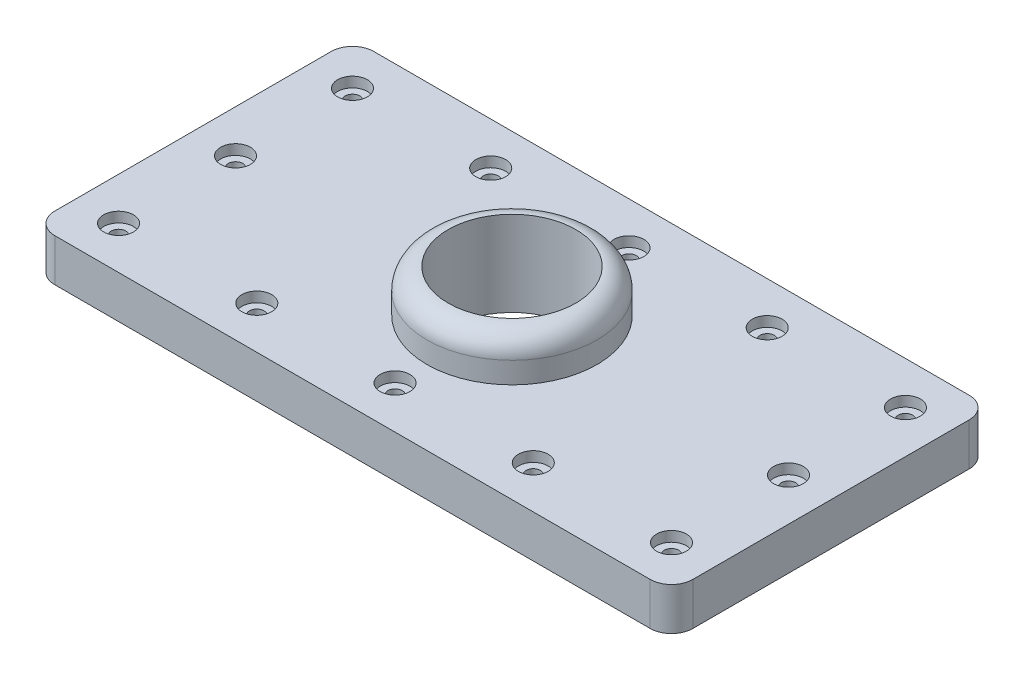
from build123d import *

# Parameters (mm, degrees)
PROFIL_BASE_W                                      = 150
PROFIL_BASE_H                                      = 75
BASE_DEPTH                                         = 10
PROFIL_CYLINDRE_R                                  = 20
CYLINDRE_DEPTH                                     = 10
CONG_1_R                                           = 5
PER_AGE_CENTRAL_D                                  = 30
CHAMBRAGE_POUR_VIS_T_TE_RONDE_BOMB_E_M_D           = 3.4
CHAMBRAGE_POUR_VIS_T_TE_RONDE_BOMB_E_M_CBORE_D     = 7
CHAMBRAGE_POUR_VIS_T_TE_RONDE_BOMB_E_M_CBORE_DEPTH = 2.4
R_P_TITION_LIN_AIRE1_COUNT                         = 5
R_P_TITION_LIN_AIRE1_PITCH                         = 32.5
R_P_TITION_LIN_AIRE1_COUNT_DIR2                    = 3
R_P_TITION_LIN_AIRE1_PITCH_DIR2                    = 27.5


with BuildPart() as part:
    # Profil Base → Base (new body)
    with BuildSketch(Plane(origin=(0, 0, 0), x_dir=(1, 0, 0), z_dir=(0, 1, 0))):
        Rectangle(PROFIL_BASE_W, PROFIL_BASE_H)
    extrude(amount=BASE_DEPTH)

    # Profil Cylindre → Cylindre (add)
    with BuildSketch(Plane(origin=(0, 10, 0), x_dir=(1, 0, 0), z_dir=(0, 1, 0))):
        with Locations(Location((0, 0, 0), (0, 0, 270))):
            Circle(PROFIL_CYLINDRE_R)
    extrude(amount=CYLINDRE_DEPTH)

    # Congé1
    cong_1_edges = [part.edges().sort_by_distance(p)[0] for p in [
        (0, 20, -20),
        (75, 5, 37.5),
        (-75, 5, 37.5),
        (-75, 5, -37.5),
        (75, 5, -37.5),
    ]]
    fillet(cong_1_edges, radius=CONG_1_R)

    # Perçage central (through all)
    with Locations(Plane(origin=(0, 20, 0), x_dir=(1, 0, 0), z_dir=(0, 1, 0))):
        with Locations((0, 0)):
            Hole(PER_AGE_CENTRAL_D / 2)

    # Chambrage pour vis à tête ronde bombée M31 (through all)
    with Locations(Plane(origin=(0, 10, 0), x_dir=(1, 0, 0), z_dir=(0, 1, 0))):
        with Locations((-65, 27.5)):
            chambrage_pour_vis_t_te_ronde_bomb_e_m = CounterBoreHole(CHAMBRAGE_POUR_VIS_T_TE_RONDE_BOMB_E_M_D / 2, CHAMBRAGE_POUR_VIS_T_TE_RONDE_BOMB_E_M_CBORE_D / 2, CHAMBRAGE_POUR_VIS_T_TE_RONDE_BOMB_E_M_CBORE_DEPTH)

    # Répétition linéaire1: Chambrage pour vis _ t_te ronde bomb_e M 5 × 3, 3 skipped
    with Locations(*[(i * R_P_TITION_LIN_AIRE1_PITCH, 0, j * R_P_TITION_LIN_AIRE1_PITCH_DIR2) for i in range(R_P_TITION_LIN_AIRE1_COUNT) for j in range(R_P_TITION_LIN_AIRE1_COUNT_DIR2) if (i, j) not in ((0, 0), (1, 1), (2, 1), (3, 1))]):
        add(chambrage_pour_vis_t_te_ronde_bomb_e_m, mode=Mode.SUBTRACT)


solid = part.part
